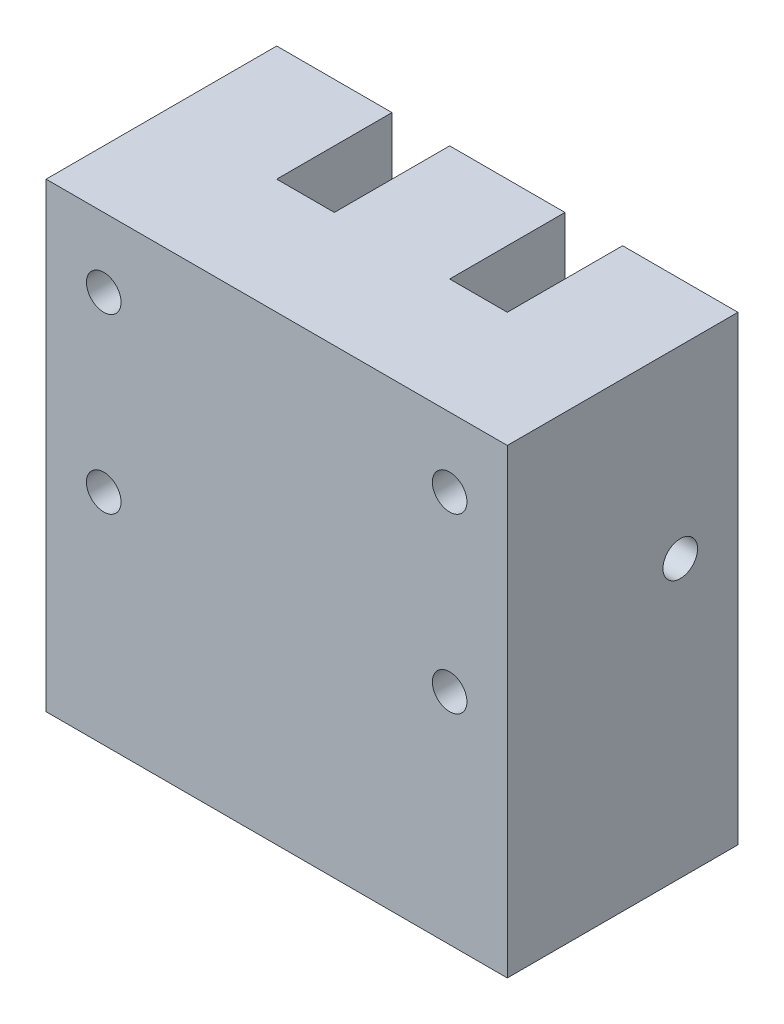
from build123d import *

# Parameters (mm, degrees)
BOSS_EXTRUDE1_DEPTH = 50.8
SKETCH2_R           = 1.75
CUT_EXTRUDE1_DEPTH  = 15.24
CUT_EXTRUDE2_REACH  = 78.2
SKETCH4_R           = 1.905
SKETCH5_R           = 1.905
CUT_EXTRUDE3_DEPTH  = 25.4
SKETCH6_R           = 1.905
CUT_EXTRUDE4_DEPTH  = 17.78


with BuildPart() as part:
    # Sketch1 → Boss-Extrude1 (new body)
    with BuildSketch(Plane(origin=(0, 0, 0), x_dir=(1, 0, 0), z_dir=(0, 1, 0))):
        Polygon((0, 0), (0, 25.4), (12.7, 25.4), (12.7, 12.7), (19.05, 12.7), (19.05, 25.4), (31.75, 25.4), (31.75, 12.7), (38.1, 12.7), (38.1, 25.4), (50.8, 25.4), (50.8, 0), align=None)
    extrude(amount=BOSS_EXTRUDE1_DEPTH)

    # Sketch2 → Cut-Extrude1 (cut)
    with BuildSketch(Plane(origin=(0, 0, -25.4), x_dir=(-1, 0, 0), z_dir=(0, 0, -1))):
        with Locations((-44.45, 6.35)):
            Circle(SKETCH2_R)
        with Locations((-6.35, 6.35)):
            Circle(SKETCH2_R)
    extrude(amount=-CUT_EXTRUDE1_DEPTH, mode=Mode.SUBTRACT)

    # Cut-Extrude2: up to this face of the body (flat: up to its plane)
    cut_extrude2_end = Plane(part.part.faces().sort_by_distance((0, 25.4, -12.7))[0])
    # Sketch4 → Cut-Extrude2 (cut, up to the picked face)
    with BuildSketch(Plane(origin=(50.8, 0, 0), x_dir=(0, 0, -1), z_dir=(1, 0, 0)), mode=Mode.PRIVATE) as cut_extrude2_sk1:
        with Locations((19.05, 30.48)):
            Circle(SKETCH4_R)
    cut_extrude2_tool1 = split(extrude(cut_extrude2_sk1.sketch, amount=-CUT_EXTRUDE2_REACH, mode=Mode.PRIVATE), bisect_by=cut_extrude2_end, keep=Keep.BOTH, mode=Mode.PRIVATE)
    add(cut_extrude2_tool1.solids().sort_by(Axis((50.8, 30.48, -19.05), (-1, 0, 0)))[0], mode=Mode.SUBTRACT)

    # Sketch5 → Cut-Extrude3 (cut)
    with BuildSketch(Plane(origin=(0, 0, -25.4), x_dir=(-1, 0, 0), z_dir=(0, 0, -1))):
        with Locations((-44.45, 24.13)):
            Circle(SKETCH5_R)
        with Locations((-44.45, 43.18)):
            Circle(SKETCH5_R)
        with Locations((-6.35, 24.13)):
            Circle(SKETCH5_R)
        with Locations((-6.35, 43.18)):
            Circle(SKETCH5_R)
    extrude(amount=-CUT_EXTRUDE3_DEPTH, mode=Mode.SUBTRACT)

    # Sketch6 → Cut-Extrude4 (cut)
    with BuildSketch(Plane.XZ):
        with Locations(Location((34.925, -6.35, 0), (0, 0, 270))):
            Circle(SKETCH6_R)
        with Locations(Location((15.875, -6.35, 0), (0, 0, 270))):
            Circle(SKETCH6_R)
        with Locations(Location((25.4, -19.05, 0), (0, 0, 270))):
            Circle(SKETCH6_R)
    extrude(amount=-CUT_EXTRUDE4_DEPTH, mode=Mode.SUBTRACT)


solid = part.part
